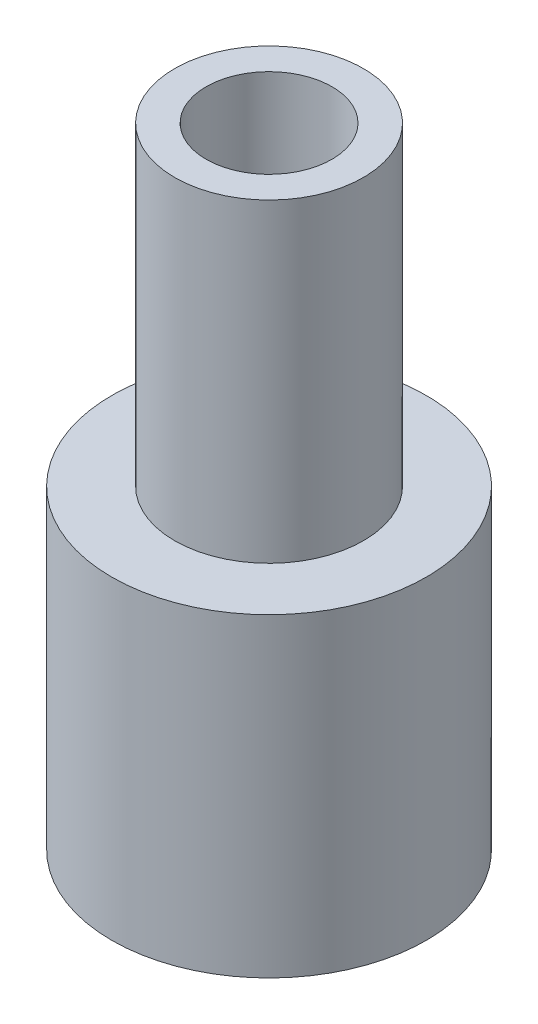
from build123d import *

# Parameters (mm, degrees)
SKETCH_1_R          = 5
EXTRUDE_1_DEPTH     = 10
SKETCH_2_R          = 3
EXTRUDE_2_DEPTH     = 10
SKETCH_3_R          = 2
CUT_EXTRUDE_1_DEPTH = 10


with BuildPart() as part:
    # 草图1 → 凸台-拉伸1 (new body)
    with BuildSketch(Plane(origin=(0, 0, 0), x_dir=(1, 0, 0), z_dir=(0, 1, 0))):
        with Locations(Location((0, 0, 0), (0, 0, 270))):
            Circle(SKETCH_1_R)
    extrude(amount=EXTRUDE_1_DEPTH)

    # 草图2 → 凸台-拉伸2 (add)
    with BuildSketch(Plane(origin=(0, 10, 0), x_dir=(1, 0, 0), z_dir=(0, 1, 0))):
        with Locations(Location((0, 0, 0), (0, 0, 270))):
            Circle(SKETCH_2_R)
    extrude(amount=EXTRUDE_2_DEPTH)

    # 草图3 → 切除-拉伸1 (cut)
    with BuildSketch(Plane(origin=(0, 20, 0), x_dir=(1, 0, 0), z_dir=(0, 1, 0))):
        with Locations(Location((0, 0, 0), (0, 0, 270))):
            Circle(SKETCH_3_R)
    extrude(amount=-CUT_EXTRUDE_1_DEPTH, mode=Mode.SUBTRACT)


solid = part.part
